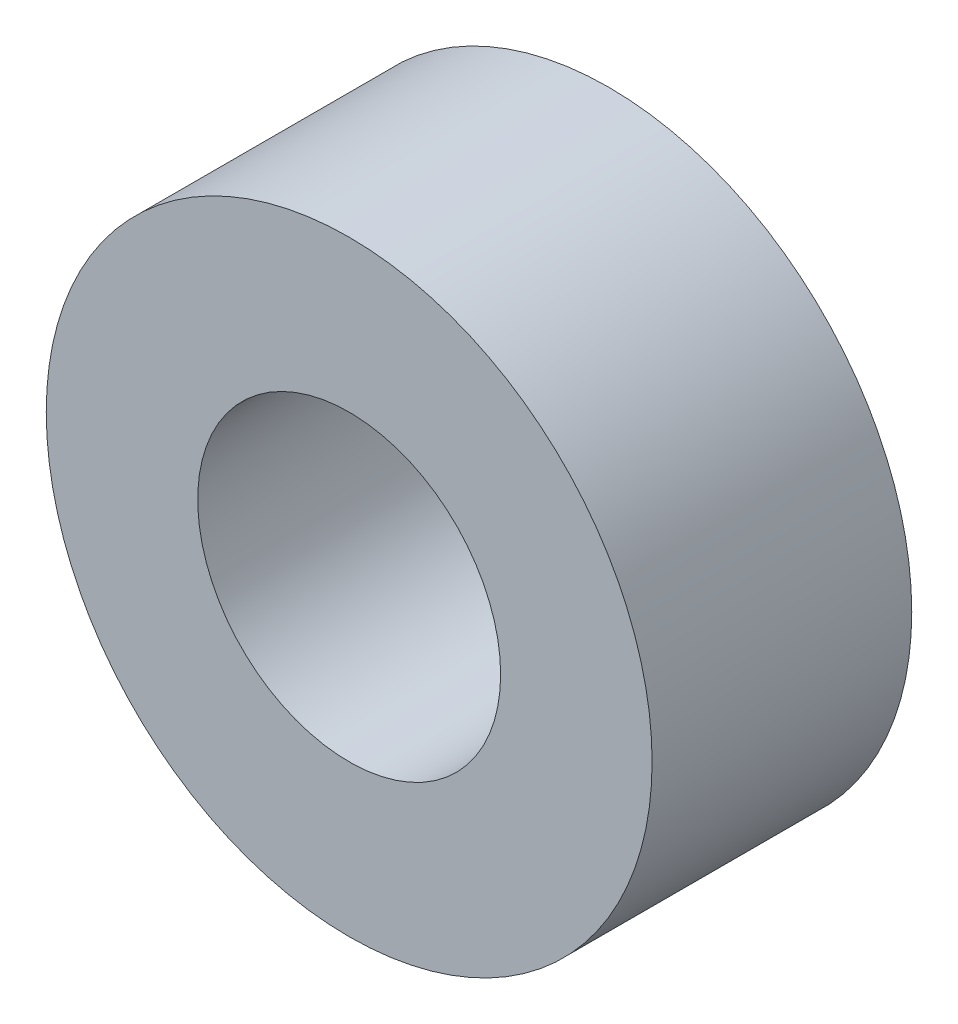
from build123d import *

# Parameters (mm, degrees)
SKETCH_1_R      = 3.5
SKETCH_1_R_2    = 1.75
EXTRUDE_1_DEPTH = 3


with BuildPart() as part:
    # Эскиз1 → Бобышка-Вытянуть1 (new body)
    with BuildSketch(Plane.XY):
        Circle(SKETCH_1_R)
        Circle(SKETCH_1_R_2, mode=Mode.SUBTRACT)
    extrude(amount=EXTRUDE_1_DEPTH)


solid = part.part
